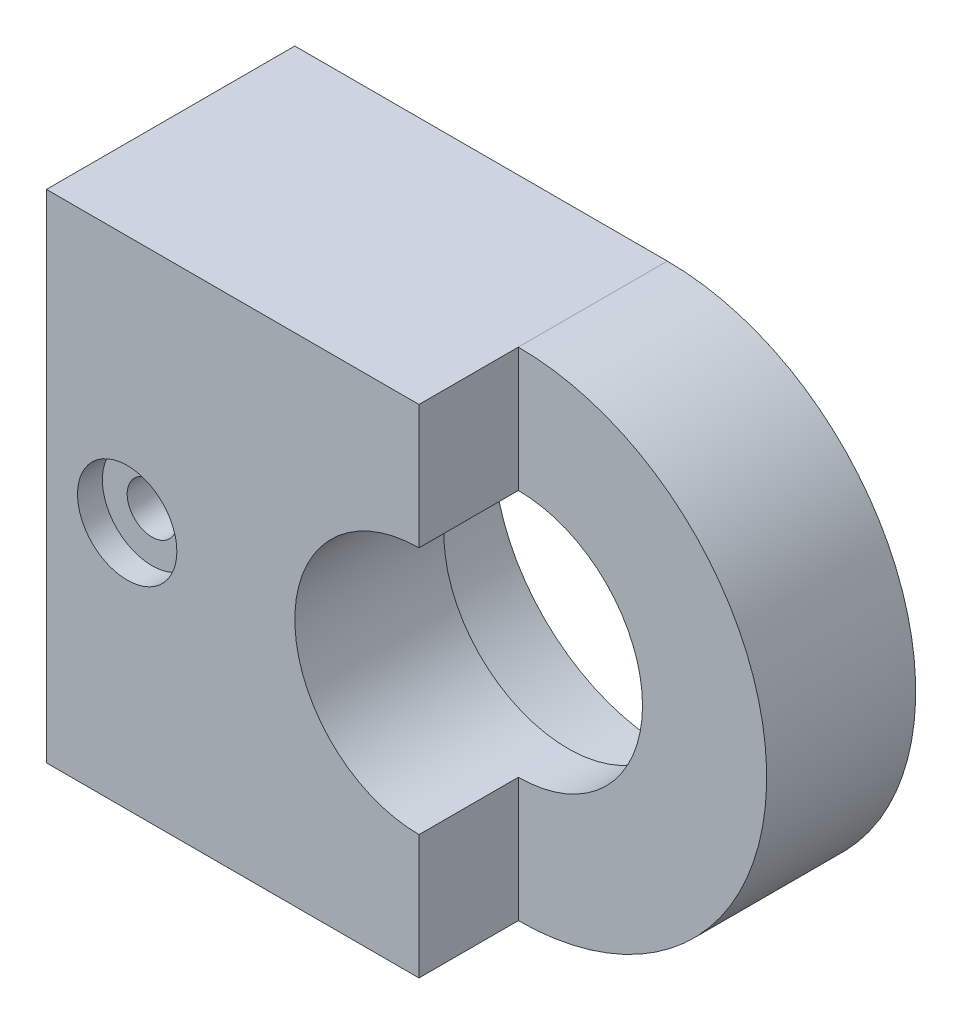
from build123d import *

# Parameters (mm, degrees)
BOSS_EXTRU_1_DEPTH           = 20
ESQUISSE1_4_R                = 14
ENL_V_MAT_EXTRU_1_DEPTH      = 8
ESQUISSE3_R                  = 5
ENL_V_MAT_EXTRU_2_DEPTH      = 14
ENL_V_MAT_EXTRU_3_DEPTH      = 42.231056256
ENL_V_MAT_EXTRU_3_DEPTH_BACK = 42.231056256
ESQUISSE1_5_R                = 2
ESQUISSE1_6_R                = 4
ENL_V_MAT_EXTRU_4_DEPTH      = 2
ENL_V_START                  = 18
ESQUISSE1_7_R                = 4
ENL_V_MAT_EXTRU_5_DEPTH      = 2
ENL_V_MAT_EXTRU_6_REACH      = 43.231
ESQUISSE4_R                  = 10
ENL_V_MAT_EXTRU_7_DEPTH      = 8


with BuildPart() as part:
    # Esquisse1 → Boss.-Extru.1 (new body)
    with BuildSketch(Plane.XY):
        with BuildLine():
            Line((0, 20), (-30, 20))
            Line((-30, 20), (-30, -20))
            Line((-30, -20), (0, -20))
            ThreePointArc((0, -20), (20, 0), (0, 20))
        make_face()
    extrude(amount=BOSS_EXTRU_1_DEPTH)

    # Esquisse1<4> → Enlèv. mat.-Extru.1 (cut)
    with BuildSketch(Plane.XY):
        Circle(ESQUISSE1_4_R)
    extrude(amount=ENL_V_MAT_EXTRU_1_DEPTH, mode=Mode.SUBTRACT)

    # Esquisse3 → Enlèv. mat.-Extru.2 (cut)
    with BuildSketch(Plane.ZY.offset(30)):
        with Locations((10, 0)):
            Circle(ESQUISSE3_R)
    extrude(amount=-ENL_V_MAT_EXTRU_2_DEPTH, mode=Mode.SUBTRACT)

    # Esquisse1<5> → Enlèv. mat.-Extru.3 (cut, two sides: drawn at the far end of the back side and taken through both)
    with BuildSketch(Plane.XY.offset(-ENL_V_MAT_EXTRU_3_DEPTH_BACK)):
        with Locations((-23.5, 0)):
            Circle(ESQUISSE1_5_R)
    extrude(amount=ENL_V_MAT_EXTRU_3_DEPTH + ENL_V_MAT_EXTRU_3_DEPTH_BACK, mode=Mode.SUBTRACT)

    # Esquisse1<6> → Enlèv. mat.-Extru.4 (cut)
    with BuildSketch(Plane.XY):
        with Locations((-23.5, 0)):
            Circle(ESQUISSE1_6_R)
    extrude(amount=ENL_V_MAT_EXTRU_4_DEPTH, mode=Mode.SUBTRACT)

    # Esquisse1<7> → Enlèv. mat.-Extru.5 (cut)
    with BuildSketch(Plane.XY.offset(ENL_V_START)):
        with Locations((-23.5, 0)):
            Circle(ESQUISSE1_7_R)
    extrude(amount=ENL_V_MAT_EXTRU_5_DEPTH, mode=Mode.SUBTRACT)

    # Esquisse4 → Enlèv. mat.-Extru.6 (cut, up to next)
    with BuildSketch(Plane.XY.offset(20), mode=Mode.PRIVATE) as enl_v_mat_extru_6_sk1:
        Circle(ESQUISSE4_R)
    enl_v_mat_extru_6_tool1 = extrude(enl_v_mat_extru_6_sk1.sketch, amount=-ENL_V_MAT_EXTRU_6_REACH, mode=Mode.PRIVATE) & part.part
    add(enl_v_mat_extru_6_tool1.solids().sort_by_distance((0, 0, 20))[0], mode=Mode.SUBTRACT)

    # Esquisse5 → Enlèv. mat.-Extru.7 (cut)
    with BuildSketch(Plane.XY.offset(20)):
        with BuildLine():
            Line((0, 10), (0, 20))
            ThreePointArc((0, 20), (20, 0), (0, -20))
            Line((0, -20), (0, -10))
            ThreePointArc((0, -10), (-10, 0), (0, 10))
        make_face()
    extrude(amount=-ENL_V_MAT_EXTRU_7_DEPTH, mode=Mode.SUBTRACT)


solid = part.part
